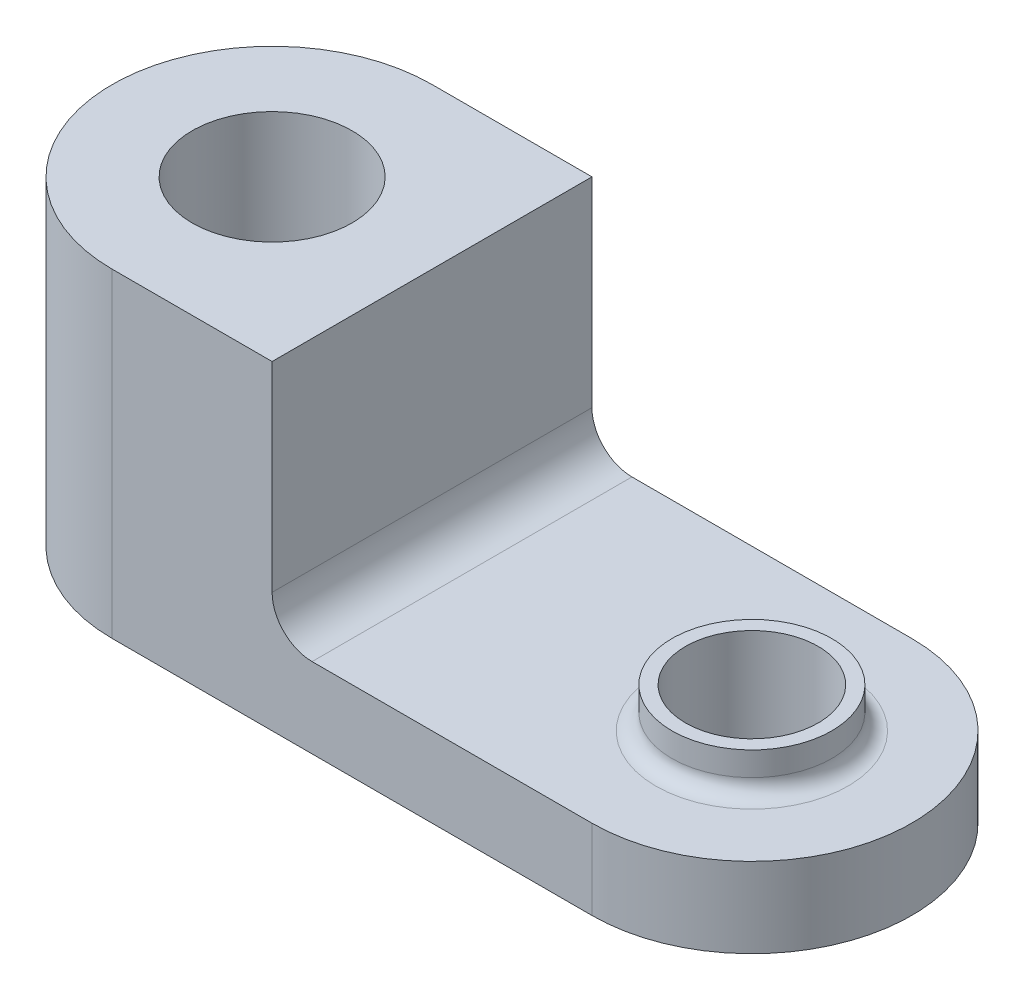
from build123d import *

# Parameters (mm, degrees)
SKETCH1_R           = 10
BOSS_EXTRUDE1_DEPTH = 10
SKETCH2_R           = 10
BOSS_EXTRUDE2_DEPTH = 30
SKETCH1_3_R         = 10
SKETCH1_3_R_2       = 8.299382461
BOSS_EXTRUDE3_DEPTH = 15
FILLET1_R           = 2
FILLET2_R           = 5


with BuildPart() as part:
    # Sketch1 → Boss-Extrude1 (new body)
    with BuildSketch(Plane(origin=(0, 0, 0), x_dir=(1, 0, 0), z_dir=(0, 1, 0))):
        with BuildLine():
            Line((-30, 20), (30, 20))
            ThreePointArc((30, 20), (50, 0), (30, -20))
            Line((30, -20), (-30, -20))
            ThreePointArc((-30, -20), (-50, 0), (-30, 20))
        make_face()
        with Locations((-30, 0)):
            Circle(SKETCH1_R, mode=Mode.SUBTRACT)
        with Locations((30, 0)):
            Circle(SKETCH1_R, mode=Mode.SUBTRACT)
    extrude(amount=BOSS_EXTRUDE1_DEPTH)

    # Sketch2 → Boss-Extrude2 (add)
    with BuildSketch(Plane(origin=(0, 10, 0), x_dir=(1, 0, 0), z_dir=(0, 1, 0))):
        with BuildLine():
            Line((-10, -20), (-30, -20))
            ThreePointArc((-30, -20), (-50, 0), (-30, 20))
            Line((-30, 20), (-10, 20))
            Line((-10, 20), (-10, -20))
        make_face()
        with Locations((-30, 0)):
            Circle(SKETCH2_R, mode=Mode.SUBTRACT)
    extrude(amount=BOSS_EXTRUDE2_DEPTH)

    # Sketch1<3> → Boss-Extrude3 (add)
    with BuildSketch(Plane(origin=(0, 0, 0), x_dir=(1, 0, 0), z_dir=(0, 1, 0))):
        with Locations((30, 0)):
            Circle(SKETCH1_3_R)
        with Locations((30, 0)):
            Circle(SKETCH1_3_R_2, mode=Mode.SUBTRACT)
    extrude(amount=BOSS_EXTRUDE3_DEPTH)

    # Fillet1
    fillet1_edges = [part.edges().sort_by_distance(p)[0] for p in [
        (20, 10, 0),
    ]]
    fillet(fillet1_edges, radius=FILLET1_R)

    # Fillet2
    fillet2_edges = [part.edges().sort_by_distance(p)[0] for p in [
        (-10, 10, 0),
    ]]
    fillet(fillet2_edges, radius=FILLET2_R)


solid = part.part
